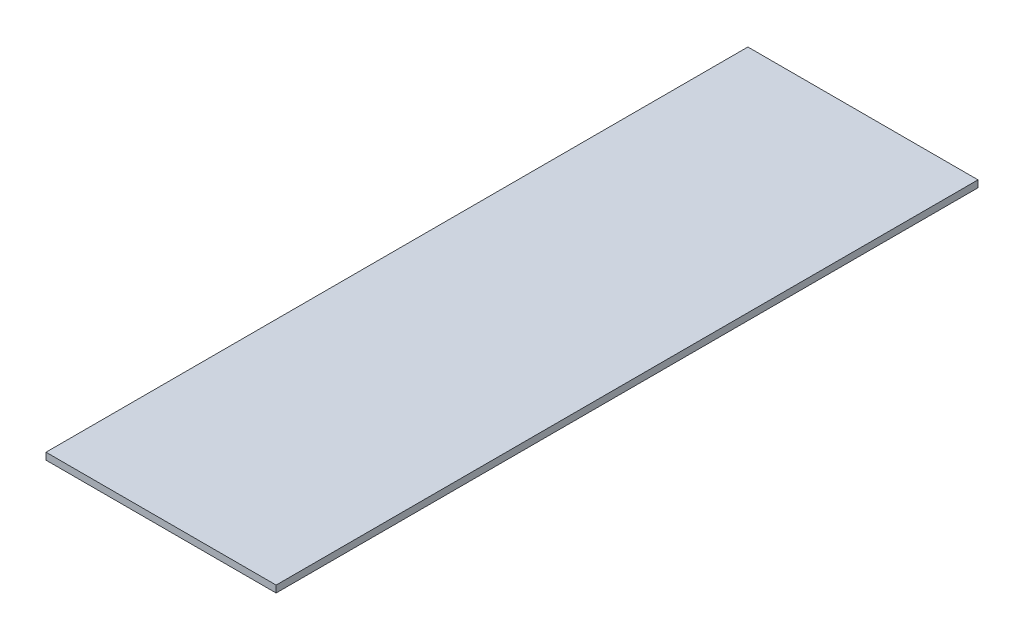
from build123d import *

# Parameters (mm, degrees)
CROQUIS1_W              = 100
CROQUIS1_H              = 310
SALIENTE_EXTRUIR1_DEPTH = 3
CROQUIS2_W              = 100
CROQUIS2_H              = 2.5
CORTAR_EXTRUIR1_DEPTH   = 10


with BuildPart() as part:
    # Croquis1 → Saliente-Extruir1 (new body)
    with BuildSketch(Plane(origin=(0, 0, 0), x_dir=(1, 0, 0), z_dir=(0, 1, 0))):
        Rectangle(CROQUIS1_W, CROQUIS1_H)
    extrude(amount=SALIENTE_EXTRUIR1_DEPTH)

    # Croquis2 → Cortar-Extruir1 (cut)
    with BuildSketch(Plane(origin=(0, 3, 0), x_dir=(1, 0, 0), z_dir=(0, 1, 0))):
        with Locations((0, 153.75)):
            Rectangle(CROQUIS2_W, CROQUIS2_H)
        with Locations((0, -153.75)):
            Rectangle(CROQUIS2_W, CROQUIS2_H)
    extrude(amount=-CORTAR_EXTRUIR1_DEPTH, mode=Mode.SUBTRACT)


solid = part.part
